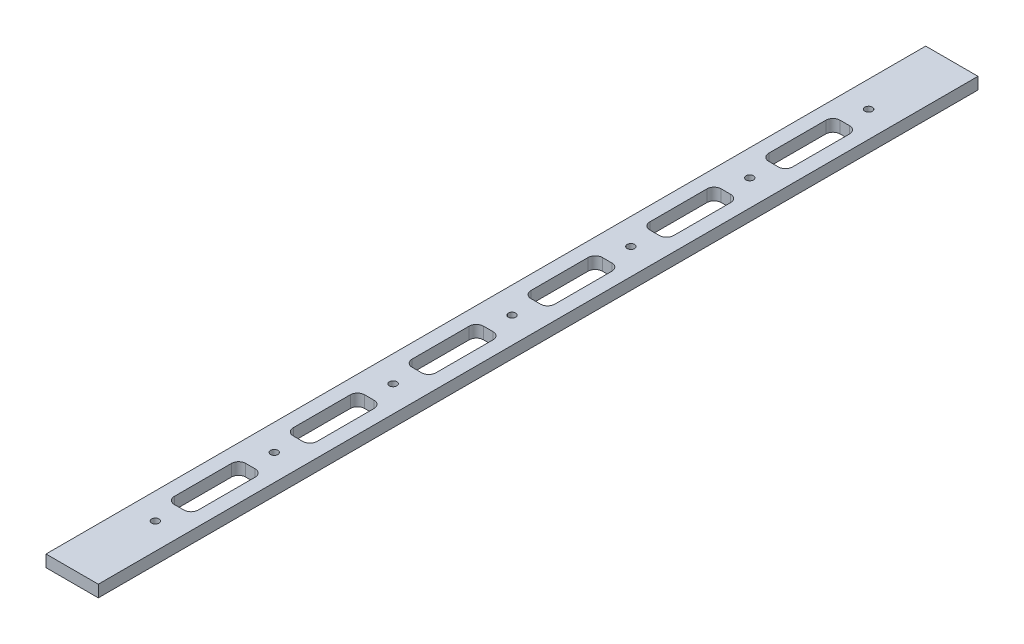
from build123d import *

# Parameters (mm, degrees)
SKETCH_1_W          = 22
SKETCH_1_H          = 370
EXTRUDE_1_DEPTH     = 5
SKETCH_2_R          = 1.55
CUT_EXTRUDE_1_DEPTH = 5
CUT_EXTRUDE_2_DEPTH = 5


with BuildPart() as part:
    # 草图1 → 凸台-拉伸1 (new body)
    with BuildSketch(Plane(origin=(0, 0, 0), x_dir=(1, 0, 0), z_dir=(0, 1, 0))):
        Rectangle(SKETCH_1_W, SKETCH_1_H)
    extrude(amount=EXTRUDE_1_DEPTH)

    # 草图2 → 切除-拉伸1 (cut)
    with BuildSketch(Plane(origin=(0, 5, 0), x_dir=(1, 0, 0), z_dir=(0, 1, 0))):
        with Locations(Location((0, 0, 0), (0, 0, 270))):
            Circle(SKETCH_2_R)
        with Locations(Location((0, 50, 0), (0, 0, 270))):
            Circle(SKETCH_2_R)
        with Locations(Location((0, 100, 0), (0, 0, 270))):
            Circle(SKETCH_2_R)
        with Locations(Location((0, 150, 0), (0, 0, 270))):
            Circle(SKETCH_2_R)
        with Locations(Location((0, -150, 0), (0, 0, 90))):
            Circle(SKETCH_2_R)
        with Locations(Location((0, -100, 0), (0, 0, 90))):
            Circle(SKETCH_2_R)
        with Locations(Location((0, -50, 0), (0, 0, 90))):
            Circle(SKETCH_2_R)
    extrude(amount=-CUT_EXTRUDE_1_DEPTH, mode=Mode.SUBTRACT)

    # 草图3 → 切除-拉伸2 (cut)
    with BuildSketch(Plane(origin=(0, 5, 0), x_dir=(1, 0, 0), z_dir=(0, 1, 0))):
        with BuildLine():
            Line((-5, 63), (-5, 87))
            ThreePointArc((-5, 87), (-4.121320344, 89.121320344), (-2, 90))
            Line((-2, 90), (2, 90))
            ThreePointArc((2, 90), (4.121320344, 89.121320344), (5, 87))
            Line((5, 87), (5, 63))
            ThreePointArc((5, 63), (4.121320344, 60.878679656), (2, 60))
            Line((2, 60), (-2, 60))
            ThreePointArc((-2, 60), (-4.121320344, 60.878679656), (-5, 63))
        make_face()
        with BuildLine():
            Line((-2, 110), (2, 110))
            ThreePointArc((2, 110), (4.121320344, 110.878679656), (5, 113))
            Line((5, 113), (5, 137))
            ThreePointArc((5, 137), (4.121320344, 139.121320344), (2, 140))
            Line((2, 140), (-2, 140))
            ThreePointArc((-2, 140), (-4.121320344, 139.121320344), (-5, 137))
            Line((-5, 137), (-5, 113))
            ThreePointArc((-5, 113), (-4.121320344, 110.878679656), (-2, 110))
        make_face()
        with BuildLine():
            Line((-5, 13), (-5, 37))
            ThreePointArc((-5, 37), (-4.121320344, 39.121320344), (-2, 40))
            Line((-2, 40), (2, 40))
            ThreePointArc((2, 40), (4.121320344, 39.121320344), (5, 37))
            Line((5, 37), (5, 13))
            ThreePointArc((5, 13), (4.121320344, 10.878679656), (2, 10))
            Line((2, 10), (-2, 10))
            ThreePointArc((-2, 10), (-4.121320344, 10.878679656), (-5, 13))
        make_face()
        with BuildLine():
            Line((-5, -37), (-5, -13))
            ThreePointArc((-5, -13), (-4.121320344, -10.878679656), (-2, -10))
            Line((-2, -10), (2, -10))
            ThreePointArc((2, -10), (4.121320344, -10.878679656), (5, -13))
            Line((5, -13), (5, -37))
            ThreePointArc((5, -37), (4.121320344, -39.121320344), (2, -40))
            Line((2, -40), (-2, -40))
            ThreePointArc((-2, -40), (-4.121320344, -39.121320344), (-5, -37))
        make_face()
        with BuildLine():
            Line((-5, -87), (-5, -63))
            ThreePointArc((-5, -63), (-4.121320344, -60.878679656), (-2, -60))
            Line((-2, -60), (2, -60))
            ThreePointArc((2, -60), (4.121320344, -60.878679656), (5, -63))
            Line((5, -63), (5, -87))
            ThreePointArc((5, -87), (4.121320344, -89.121320344), (2, -90))
            Line((2, -90), (-2, -90))
            ThreePointArc((-2, -90), (-4.121320344, -89.121320344), (-5, -87))
        make_face()
        with BuildLine():
            Line((-5, -137), (-5, -113))
            ThreePointArc((-5, -113), (-4.121320344, -110.878679656), (-2, -110))
            Line((-2, -110), (2, -110))
            ThreePointArc((2, -110), (4.121320344, -110.878679656), (5, -113))
            Line((5, -113), (5, -137))
            ThreePointArc((5, -137), (4.121320344, -139.121320344), (2, -140))
            Line((2, -140), (-2, -140))
            ThreePointArc((-2, -140), (-4.121320344, -139.121320344), (-5, -137))
        make_face()
    extrude(amount=-CUT_EXTRUDE_2_DEPTH, mode=Mode.SUBTRACT)


solid = part.part
